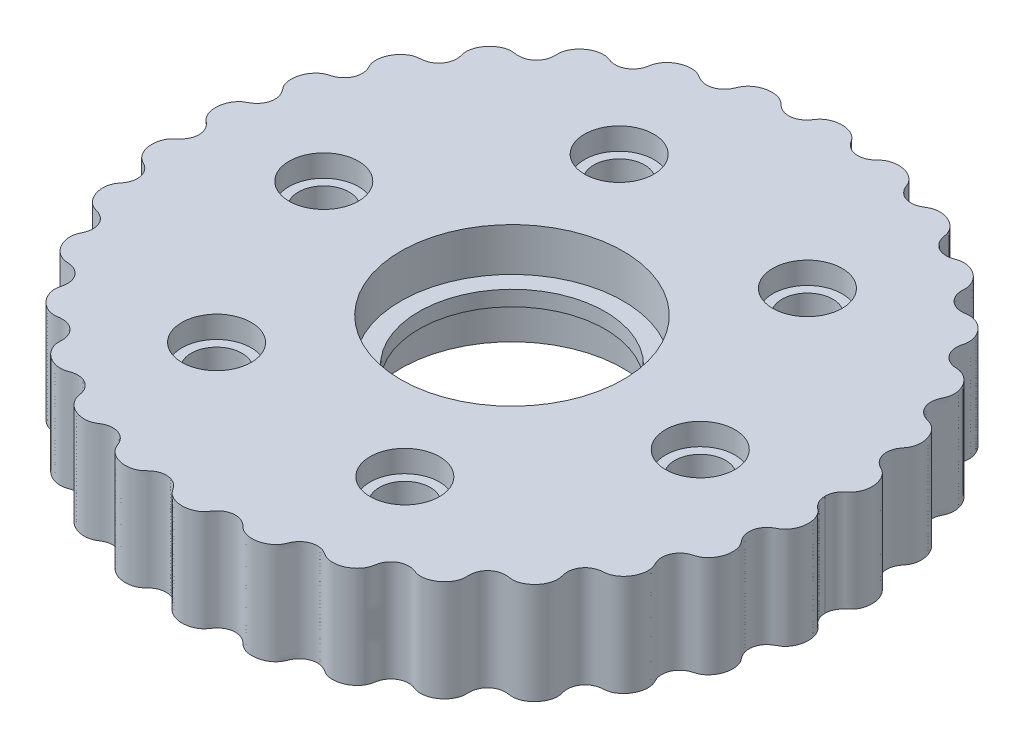
from build123d import *

# Parameters (mm, degrees)
BOSS_EXTRUDE2_DEPTH = 12
SKETCH6_R           = 4.1
CUT_EXTRUDE1_DEPTH  = 57.308702993
SKETCH7_R           = 13.15
CUT_EXTRUDE2_DEPTH  = 57.308702993
BOSS_EXTRUDE3_START = -9.4
SKETCH9_R           = 4.1
SKETCH9_R_2         = 3
BOSS_EXTRUDE3_DEPTH = 9.4
CIRPATTERN1_COUNT   = 6
SKETCH10_R          = 15
SKETCH10_R_2        = 11
BOSS_EXTRUDE4_DEPTH = 0.9


with BuildPart() as part:
    # Sketch5 → Boss-Extrude2 (new body)
    with BuildSketch(Plane(origin=(0, 0, 0), x_dir=(1, 0, 0), z_dir=(0, 1, 0))):
        with BuildLine():
            add(Edge.make_bspline(
                [(37.000000543, 0), (37.000000552, -0.009331134), (37.000966509, -0.171424116), (37.027070206, -0.409679845), (37.109321598, -0.716273392), (37.286261597, -1.078952504), (37.456824445, -1.324487686), (37.638362652, -1.52485155), (37.816819625, -1.687958329), (37.965246324, -1.811823941), (38.110225291, -1.939883113), (38.242117445, -2.08169884), (38.364952466, -2.243161776), (38.476615549, -2.423549989), (38.60066785, -2.673492576), (38.75424375, -3.109394369), (38.830307319, -3.632927608), (38.794292176, -4.2239939), (38.636848668, -4.797928431), (38.458890502, -5.183344411), (38.259405548, -5.487184723), (38.069505107, -5.707021167), (37.910862366, -5.85690611), (37.747040399, -5.982632822), (37.581182626, -6.08431324), (37.409262532, -6.175045447), (37.239463579, -6.269587357), (37.035066315, -6.401347188), (36.823394382, -6.571066904), (36.616578503, -6.787868402), (36.386380736, -7.119494054), (36.202652154, -7.537360036), (36.123975575, -7.987062037), (36.153590291, -8.437242816), (36.250456351, -8.815357689), (36.362978783, -9.082196629), (36.494221651, -9.309281938), (36.630083941, -9.501001968), (36.745699391, -9.649082743), (36.887252239, -9.836666119), (37.011266131, -10.051345791), (37.109368864, -10.292226805), (37.196288214, -10.611443823), (37.261909013, -11.081574388), (37.228744801, -11.621563903), (37.067186773, -12.203062395), (36.787563361, -12.738446309), (36.529525865, -13.079532461), (36.267442309, -13.33526978), (36.032623997, -13.509988526), (35.843612941, -13.622491105), (35.654601989, -13.709631656), (35.468926378, -13.772818106), (35.233120316, -13.838805413), (34.953875759, -13.931517528), (34.663032698, -14.072976375), (34.376392401, -14.275606179), (34.08511956, -14.559566304), (33.825233374, -14.936045378), (33.663332771, -15.362756008), (33.607510823, -15.808988758), (33.630241415, -16.195475852), (33.688792421, -16.476697926), (33.772611091, -16.723045921), (33.867027273, -16.936221606), (33.949151097, -17.103603609), (34.045620211, -17.3159684), (34.118259653, -17.55104717), (34.161123554, -17.80549671), (34.176642117, -18.133452615), (34.139990376, -18.603020205), (33.993802903, -19.119514254), (33.715292747, -19.649643893), (33.332605178, -20.110935737), (33.011583256, -20.388596999), (32.704572477, -20.582893614), (32.440787073, -20.704495969), (32.234310047, -20.775237155), (32.033040809, -20.821610611), (31.839904391, -20.845433979), (31.645883956, -20.85805711), (31.452290476, -20.876358937), (31.212166227, -20.915198636), (30.945924495, -20.987357063), (30.661712224, -21.107849), (30.304805692, -21.332562146), (29.964326123, -21.660076524), (29.717872228, -22.056290276), (29.577021526, -22.488973098), (29.525925808, -22.869493379), (29.529120795, -23.154434942), (29.563002852, -23.410385086), (29.612749759, -23.636381115), (29.658085535, -23.815826077), (29.705219825, -24.042553058), (29.723756744, -24.286058245), (29.71019054, -24.541725861), (29.654670682, -24.862775407), (29.519045475, -25.309928362), (29.266982699, -25.782122921), (28.881776698, -26.241648746), (28.406724995, -26.61299827), (28.027811952, -26.817810293), (27.680597553, -26.942068849), (27.391770251, -27.002991395), (27.170545775, -27.025851757), (26.95964549, -27.024757293), (26.761637939, -27.003079534), (26.564666788, -26.974537259), (26.36649682, -26.954976795), (26.117509902, -26.948552815), (25.761048422, -26.978767865), (25.308882571, -27.104292051), (24.82399189, -27.390850133), (24.414833141, -27.833890192), (24.171713809, -28.315389079), (24.072871169, -28.730278121), (24.04885786, -29.061600015), (24.052107268, -29.301235182), (24.059405849, -29.492811283), (24.054566832, -29.732676009), (24.00665518, -30.035462361), (23.889663083, -30.389531673), (23.628504038, -30.876963361), (23.248732953, -31.319620737), (22.779834744, -31.682021375), (22.239541076, -31.942932881), (21.822657715, -32.063017543), (21.454174138, -32.110045111), (21.156890702, -32.106816463), (20.934412753, -32.080593957), (20.727509337, -32.032609435), (20.537685466, -31.967834996), (20.349458661, -31.898960578), (20.157737512, -31.840018847), (19.913114009, -31.784469338), (19.554924705, -31.744675311), (19.083470078, -31.781408492), (18.550746814, -31.97168416), (18.121409228, -32.288341346), (17.83759494, -32.624204261), (17.650380906, -32.944672377), (17.544849761, -33.20217261), (17.476444072, -33.447334524), (17.432424993, -33.673761408), (17.400602662, -33.85557284), (17.347794446, -34.080346505), (17.261667886, -34.307758417), (17.142649249, -34.532709023), (16.959053561, -34.799074104), (16.652218459, -35.145911365), (16.228738386, -35.470018351), (15.687658965, -35.729259155), (15.098286894, -35.871191466), (14.662340956, -35.899758926), (14.289767353, -35.866240575), (13.998232661, -35.798125707), (13.785333178, -35.723404174), (13.592777376, -35.630258581), (13.420264948, -35.525172488), (13.248810245, -35.418581108), (13.07126992, -35.322090415), (12.840613485, -35.218901831), (12.494392949, -35.109600037), (12.021113687, -35.054785279), (11.459467432, -35.140976143), (10.976949371, -35.371555576), (10.635072377, -35.647612606), (10.391924904, -35.924840271), (10.240095725, -36.155495721), (10.126319561, -36.380626993), (10.038719371, -36.591463894), (9.969717125, -36.760672609), (9.869305887, -36.966034651), (9.736351706, -37.166831626), (9.572653976, -37.358665188), (9.337752536, -37.577163317), (8.966477077, -37.847931402), (8.49084148, -38.07119116), (7.919231414, -38.208465327), (7.329130718, -38.22615196), (6.912384672, -38.16985048), (6.566647583, -38.069475397), (6.298290075, -37.951321292), (6.101098907, -37.838579235), (5.922744538, -37.708104642), (5.764835617, -37.562935078), (5.611399096, -37.413468174), (5.449114463, -37.273252617), (5.23266547, -37.114897644), (4.903709259, -36.931207807), (4.43889295, -36.781365035), (3.865259393, -36.759207028), (3.283433549, -36.910613806), (2.828765266, -37.176018701), (2.531290016, -37.453197215), (2.335949698, -37.698334138), (2.210101872, -37.881225878), (2.110163931, -38.02810872), (1.973558845, -38.203429319), (1.771063045, -38.404846505), (1.48944576, -38.610665257), (1.025985501, -38.844567857), (0.498046272, -38.985247931), (-0.053180337, -39.022896951), (-0.605938875, -38.953489163), (-0.989950819, -38.843837832), (-1.303041648, -38.706345322), (-1.577360136, -38.545177989), (-1.777137251, -38.394986802), (-1.949465412, -38.230038213), (-2.091676668, -38.053880482), (-2.194368107, -37.904863668), (-2.321493849, -37.717909649), (-2.518004339, -37.466821079), (-2.818364982, -37.1827623), (-3.277228537, -36.912423315), (-3.863111662, -36.759124462), (-4.438892572, -36.781364749), (-4.903709467, -36.931207971), (-5.232665361, -37.114897556), (-5.449114527, -37.273252669), (-5.611399063, -37.413468147), (-5.764835632, -37.562935089), (-5.92274453, -37.708104638), (-6.101098913, -37.838579237), (-6.298290067, -37.951321292), (-6.566647597, -38.069475397), (-6.912384646, -38.169850482), (-7.329130761, -38.226151957), (-7.91923134, -38.208465334), (-8.490841609, -38.071191148), (-8.966476892, -37.847931419), (-9.337752758, -37.577163295), (-9.572653573, -37.358665226), (-9.736352607, -37.166831539), (-9.869304158, -36.966034816), (-9.96972047, -36.760672289), (-10.038709568, -36.591464835), (-10.126342093, -36.380624831), (-10.271278494, -36.093704594), (-10.513343454, -35.754971914), (-10.913760508, -35.40176101), (-11.459451313, -35.14097769), (-12.021124524, -35.054784239), (-12.49438679, -35.109600627), (-12.840616669, -35.218901526), (-13.071268033, -35.322090596), (-13.248811124, -35.418581024), (-13.420264643, -35.525172518), (-13.592777463, -35.630258572), (-13.785333147, -35.723404177), (-13.998232674, -35.798125706), (-14.289767346, -35.866240576), (-14.662340961, -35.899758925), (-15.098286891, -35.871191466), (-15.687658967, -35.729259155), (-16.228738385, -35.470018352), (-16.652218459, -35.145911365), (-16.95905356, -34.799074104), (-17.142649249, -34.532709023), (-17.261667886, -34.307758417), (-17.347794446, -34.080346505), (-17.400602662, -33.85557284), (-17.432424993, -33.673761408), (-17.476444072, -33.447334524), (-17.544849761, -33.20217261), (-17.650380906, -32.944672377), (-17.83759494, -32.624204261), (-18.121409228, -32.288341346), (-18.550746814, -31.97168416), (-19.083470078, -31.781408492), (-19.554924705, -31.744675311), (-19.913114009, -31.784469338), (-20.157737512, -31.840018847), (-20.349458661, -31.898960578), (-20.537685466, -31.967834996), (-20.727509337, -32.032609435), (-20.934412753, -32.080593957), (-21.156890702, -32.106816463), (-21.454174138, -32.110045111), (-21.822657715, -32.063017543), (-22.239541076, -31.942932881), (-22.779834744, -31.682021375), (-23.248732953, -31.319620737), (-23.628504038, -30.876963361), (-23.889663083, -30.389531673), (-24.00665518, -30.035462361), (-24.054566832, -29.732676009), (-24.059405849, -29.492811283), (-24.052107268, -29.301235182), (-24.04885786, -29.061600015), (-24.072871169, -28.730278121), (-24.171713809, -28.315389079), (-24.414833141, -27.833890192), (-24.82399189, -27.390850133), (-25.308882571, -27.104292051), (-25.761048422, -26.978767865), (-26.117509902, -26.948552815), (-26.36649682, -26.954976795), (-26.564666788, -26.974537259), (-26.761637939, -27.003079534), (-26.95964549, -27.024757293), (-27.170545775, -27.025851757), (-27.391770251, -27.002991395), (-27.680597553, -26.942068849), (-28.027811952, -26.817810293), (-28.406724995, -26.61299827), (-28.881776698, -26.241648746), (-29.266982699, -25.782122921), (-29.519045475, -25.309928362), (-29.654670682, -24.862775407), (-29.71019054, -24.541725861), (-29.723756744, -24.286058245), (-29.705219825, -24.042553058), (-29.658085535, -23.815826077), (-29.612749759, -23.636381115), (-29.563002852, -23.410385086), (-29.529120795, -23.154434942), (-29.525925808, -22.869493379), (-29.577021526, -22.488973098), (-29.717872228, -22.056290276), (-29.964326123, -21.660076524), (-30.304805692, -21.332562146), (-30.661712224, -21.107849), (-30.945924495, -20.987357063), (-31.212166227, -20.915198636), (-31.452290476, -20.876358937), (-31.645883956, -20.85805711), (-31.839904391, -20.845433979), (-32.033040809, -20.821610611), (-32.234310047, -20.775237155), (-32.440787073, -20.704495969), (-32.704572477, -20.582893614), (-33.011583256, -20.388596999), (-33.332605178, -20.110935737), (-33.715292747, -19.649643893), (-33.993802903, -19.119514254), (-34.139990376, -18.603020205), (-34.176642117, -18.133452615), (-34.161123554, -17.80549671), (-34.118259653, -17.55104717), (-34.045620211, -17.3159684), (-33.949151097, -17.103603609), (-33.867027273, -16.936221606), (-33.772611091, -16.723045921), (-33.688792421, -16.476697926), (-33.630241415, -16.195475852), (-33.607510823, -15.808988758), (-33.663332771, -15.362756008), (-33.825233374, -14.936045378), (-34.08511956, -14.559566304), (-34.376392401, -14.275606179), (-34.663032698, -14.072976375), (-34.953875759, -13.931517528), (-35.233120316, -13.838805413), (-35.468926378, -13.772818106), (-35.654601989, -13.709631656), (-35.843612941, -13.622491105), (-36.032623997, -13.509988526), (-36.267442309, -13.33526978), (-36.529525865, -13.079532461), (-36.787563361, -12.738446309), (-37.067186773, -12.203062395), (-37.228744801, -11.621563903), (-37.261909013, -11.081574388), (-37.196288214, -10.611443823), (-37.109368864, -10.292226805), (-37.011266131, -10.051345791), (-36.887252239, -9.836666119), (-36.745699391, -9.649082743), (-36.630083941, -9.501001968), (-36.494221651, -9.309281938), (-36.362978783, -9.082196629), (-36.250456351, -8.815357689), (-36.153590291, -8.437242816), (-36.123975575, -7.987062037), (-36.202652154, -7.537360036), (-36.386380736, -7.119494054), (-36.616578503, -6.787868402), (-36.823394382, -6.571066904), (-37.035066315, -6.401347188), (-37.239463579, -6.269587357), (-37.409262532, -6.175045447), (-37.581182626, -6.08431324), (-37.747040399, -5.982632822), (-37.910862366, -5.85690611), (-38.069505107, -5.707021167), (-38.259405548, -5.487184723), (-38.458890502, -5.183344411), (-38.636848668, -4.797928431), (-38.794292176, -4.2239939), (-38.830307319, -3.632927608), (-38.75424375, -3.109394369), (-38.60066785, -2.673492576), (-38.476615549, -2.423549989), (-38.364952466, -2.243161776), (-38.242117445, -2.08169884), (-38.110225291, -1.939883113), (-37.965246324, -1.811823941), (-37.816819625, -1.687958329), (-37.638362652, -1.52485155), (-37.456824445, -1.324487687), (-37.286261596, -1.078952504), (-37.109321598, -0.716273393), (-37.027070205, -0.409679844), (-37.000966509, -0.171424116), (-37.000000553, -0.009331134), (-37.000000543, 0)],
                knots=[0.109164453, 0.109164453, 0.109164453, 0.109164453, 0.109164453, 0.109374197, 0.112807951, 0.114524828, 0.116241704, 0.118414412, 0.119500765, 0.120587119, 0.121673472, 0.122759826, 0.123846179, 0.124932533, 0.126226897, 0.127521261, 0.130109988, 0.135287444, 0.138000846, 0.140714248, 0.14342765, 0.144784351, 0.146141052, 0.147233132, 0.148325212, 0.149417293, 0.150509373, 0.151601454, 0.152693534, 0.154877695, 0.15659254, 0.158307385, 0.161737075, 0.165054367, 0.166713014, 0.16837166, 0.170483268, 0.171539072, 0.172594876, 0.17365068, 0.174706484, 0.176818092, 0.178146984, 0.179475875, 0.182133657, 0.187449222, 0.190182597, 0.192915972, 0.195649347, 0.197016035, 0.198382722, 0.199483684, 0.200584646, 0.201685608, 0.20278657, 0.204988494, 0.207190417, 0.208917605, 0.210644794, 0.21409917, 0.21738911, 0.21903408, 0.22067905, 0.222774568, 0.223822327, 0.224870086, 0.225917845, 0.226965604, 0.229061122, 0.230379854, 0.231698586, 0.23433605, 0.239610977, 0.242323594, 0.245036211, 0.247748828, 0.249105136, 0.250461445, 0.251553921, 0.252646397, 0.253738873, 0.254831349, 0.255923825, 0.257016301, 0.259201253, 0.261016111, 0.262830969, 0.266460685, 0.269722758, 0.271353794, 0.27298483, 0.275064955, 0.276105017, 0.277145079, 0.278185142, 0.279225204, 0.281305329, 0.282613797, 0.283922265, 0.2865392, 0.291773071, 0.294525562, 0.297278052, 0.300030542, 0.301406787, 0.302783032, 0.303901474, 0.305019915, 0.306138357, 0.307256798, 0.308375239, 0.309493681, 0.311730563, 0.315275739, 0.318820915, 0.321962541, 0.325104167, 0.327258622, 0.32833585, 0.329413077, 0.330490304, 0.331567532, 0.333721986, 0.336275239, 0.338828492, 0.343934998, 0.346707206, 0.349479414, 0.352251622, 0.353637726, 0.35502383, 0.356150198, 0.357276567, 0.358402935, 0.359529304, 0.360655672, 0.361782041, 0.364034778, 0.367607117, 0.371179457, 0.374302506, 0.37586403, 0.377425555, 0.379499514, 0.380536493, 0.381573473, 0.382610452, 0.383647431, 0.38572139, 0.387018316, 0.388315242, 0.390909094, 0.396096799, 0.398888162, 0.401679525, 0.404470889, 0.40586657, 0.407262252, 0.408396802, 0.409531351, 0.410665901, 0.411800451, 0.412935, 0.41406955, 0.416338649, 0.41993733, 0.42353601, 0.426642941, 0.428196407, 0.429749872, 0.431802898, 0.432829411, 0.433855924, 0.434882437, 0.43590895, 0.437961976, 0.439249052, 0.440536128, 0.443110279, 0.448258581, 0.450946418, 0.453634256, 0.456322093, 0.457666011, 0.45900993, 0.460213939, 0.461417947, 0.462621956, 0.463825965, 0.465029973, 0.466233982, 0.468642, 0.472266184, 0.475890368, 0.478932941, 0.481975513, 0.483971651, 0.48496972, 0.485967788, 0.486965857, 0.487963926, 0.489960063, 0.492365045, 0.494770027, 0.499579991, 0.50213441, 0.50468883, 0.507243249, 0.508520459, 0.509797669, 0.511830665, 0.512847163, 0.51386366, 0.514880158, 0.515896656, 0.517929652, 0.521019785, 0.524109917, 0.527734102, 0.531358286, 0.533766303, 0.534970312, 0.536174321, 0.537378329, 0.538582338, 0.539786347, 0.540990355, 0.542334274, 0.543678193, 0.54636603, 0.549053867, 0.551741704, 0.556890007, 0.559464158, 0.560751233, 0.562038309, 0.564091335, 0.565117848, 0.566144361, 0.567170874, 0.568197387, 0.570250413, 0.573357344, 0.576464275, 0.580062956, 0.583661636, 0.585930735, 0.587065285, 0.588199835, 0.589334384, 0.590468934, 0.591603484, 0.592738033, 0.594133715, 0.595529397, 0.59832076, 0.601112123, 0.603903487, 0.609091191, 0.611685043, 0.612981969, 0.614278895, 0.616352854, 0.617389833, 0.618426813, 0.619463792, 0.620500772, 0.62257473, 0.624136255, 0.62569778, 0.628820829, 0.632393168, 0.635965507, 0.638218244, 0.639344613, 0.640470981, 0.64159735, 0.642723719, 0.643850087, 0.644976456, 0.64636256, 0.647748664, 0.650520872, 0.653293079, 0.656065287, 0.661171793, 0.663725046, 0.666278299, 0.668432754, 0.669509981, 0.670587208, 0.671664436, 0.672741663, 0.674896118, 0.678037744, 0.681179371, 0.684724546, 0.688269722, 0.690506605, 0.691625046, 0.692743487, 0.693861929, 0.69498037, 0.696098812, 0.697217253, 0.698593498, 0.699969743, 0.702722233, 0.705474724, 0.708227214, 0.713461085, 0.716078021, 0.717386488, 0.718694956, 0.720775081, 0.721815144, 0.722855206, 0.723895268, 0.724935331, 0.727015456, 0.728646492, 0.730277528, 0.7335396, 0.737169316, 0.738984174, 0.740799032, 0.742983985, 0.744076461, 0.745168937, 0.746261413, 0.747353889, 0.748446365, 0.749538841, 0.750895149, 0.752251457, 0.754964074, 0.757676691, 0.760389308, 0.765664236, 0.768301699, 0.769620431, 0.770939163, 0.773034681, 0.77408244, 0.775130199, 0.776177958, 0.777225717, 0.779321235, 0.780966205, 0.782611175, 0.785901115, 0.789355492, 0.79108268, 0.792809868, 0.795011792, 0.797213716, 0.798314677, 0.799415639, 0.800516601, 0.801617563, 0.802984251, 0.804350938, 0.807084313, 0.809817688, 0.812551063, 0.817866628, 0.820524411, 0.821853302, 0.823182193, 0.825293801, 0.826349605, 0.827405409, 0.828461213, 0.829517017, 0.831628625, 0.833287272, 0.834945918, 0.838263211, 0.841692901, 0.843407746, 0.845122591, 0.847306751, 0.848398832, 0.849490912, 0.850582993, 0.851675073, 0.852767153, 0.853859234, 0.855215935, 0.856572636, 0.859286038, 0.86199944, 0.864712842, 0.869890297, 0.872479025, 0.873773388, 0.875067752, 0.876154106, 0.877240459, 0.878326813, 0.879413167, 0.88049952, 0.881585874, 0.883758581, 0.885475458, 0.887192335, 0.890626089, 0.890835832, 0.890835832, 0.890835832, 0.890835832, 0.890835832], degree=4))
            add(Edge.make_bspline(
                [(37.000000543, 0), (37.000000552, 0.009331134), (37.000966509, 0.171424116), (37.027070206, 0.409679845), (37.109321598, 0.716273392), (37.286261597, 1.078952504), (37.456824445, 1.324487686), (37.638362652, 1.52485155), (37.816819625, 1.687958329), (37.965246324, 1.811823941), (38.110225291, 1.939883113), (38.242117445, 2.08169884), (38.364952466, 2.243161776), (38.476615549, 2.423549989), (38.60066785, 2.673492576), (38.75424375, 3.109394369), (38.830307319, 3.632927608), (38.794292176, 4.2239939), (38.636848668, 4.797928431), (38.458890502, 5.183344411), (38.259405548, 5.487184723), (38.069505107, 5.707021167), (37.910862366, 5.85690611), (37.747040399, 5.982632822), (37.581182626, 6.08431324), (37.409262532, 6.175045447), (37.239463579, 6.269587357), (37.035066315, 6.401347188), (36.823394382, 6.571066904), (36.616578503, 6.787868402), (36.386380736, 7.119494054), (36.202652154, 7.537360036), (36.123975575, 7.987062037), (36.153590291, 8.437242816), (36.250456351, 8.815357689), (36.362978783, 9.082196629), (36.494221651, 9.309281938), (36.630083941, 9.501001968), (36.745699391, 9.649082743), (36.887252239, 9.836666119), (37.011266131, 10.051345791), (37.109368864, 10.292226805), (37.196288214, 10.611443823), (37.261909013, 11.081574388), (37.228744801, 11.621563903), (37.067186773, 12.203062395), (36.787563361, 12.738446308), (36.529525865, 13.079532461), (36.267442309, 13.33526978), (36.032623997, 13.509988526), (35.843612941, 13.622491105), (35.654601989, 13.709631656), (35.468926378, 13.772818106), (35.233120316, 13.838805413), (34.953875759, 13.931517528), (34.663032698, 14.072976375), (34.376392401, 14.275606179), (34.08511956, 14.559566304), (33.825233374, 14.936045378), (33.663332771, 15.362756008), (33.607510823, 15.808988758), (33.630241415, 16.195475852), (33.688792421, 16.476697926), (33.772611091, 16.723045921), (33.867027273, 16.936221606), (33.949151097, 17.103603609), (34.045620211, 17.3159684), (34.118259653, 17.55104717), (34.161123554, 17.80549671), (34.176642117, 18.133452615), (34.139990376, 18.603020205), (33.993802903, 19.119514254), (33.715292747, 19.649643893), (33.332605178, 20.110935737), (33.011583256, 20.388596999), (32.704572477, 20.582893614), (32.440787073, 20.704495969), (32.234310047, 20.775237155), (32.033040809, 20.821610611), (31.839904391, 20.845433979), (31.645883956, 20.85805711), (31.452290476, 20.876358937), (31.212166227, 20.915198636), (30.945924495, 20.987357063), (30.661712224, 21.107849), (30.304805692, 21.332562146), (29.964326123, 21.660076524), (29.717872228, 22.056290276), (29.577021526, 22.488973098), (29.525925808, 22.869493379), (29.529120795, 23.154434942), (29.563002852, 23.410385086), (29.612749759, 23.636381115), (29.658085535, 23.815826077), (29.705219825, 24.042553058), (29.723756744, 24.286058245), (29.71019054, 24.541725861), (29.654670682, 24.862775407), (29.519045475, 25.309928362), (29.266982699, 25.782122921), (28.881776698, 26.241648746), (28.406724995, 26.61299827), (28.027811952, 26.817810293), (27.680597553, 26.942068849), (27.391770251, 27.002991395), (27.170545775, 27.025851757), (26.95964549, 27.024757293), (26.761637939, 27.003079534), (26.564666788, 26.974537259), (26.36649682, 26.954976795), (26.117509902, 26.948552815), (25.761048422, 26.978767865), (25.308882571, 27.104292051), (24.82399189, 27.390850133), (24.414833141, 27.833890192), (24.171713809, 28.315389079), (24.072871169, 28.730278121), (24.04885786, 29.061600015), (24.052107268, 29.301235182), (24.059405849, 29.492811283), (24.054566832, 29.732676009), (24.00665518, 30.035462361), (23.889663083, 30.389531673), (23.628504038, 30.876963361), (23.248732953, 31.319620737), (22.779834744, 31.682021375), (22.239541076, 31.942932881), (21.822657715, 32.063017543), (21.454174138, 32.110045111), (21.156890702, 32.106816462), (20.934412753, 32.080593957), (20.727509337, 32.032609435), (20.537685466, 31.967834996), (20.349458661, 31.898960578), (20.157737512, 31.840018847), (19.913114009, 31.784469338), (19.554924705, 31.744675311), (19.083470078, 31.781408492), (18.550746815, 31.97168416), (18.121409228, 32.288341346), (17.83759494, 32.624204261), (17.650380906, 32.944672377), (17.544849761, 33.20217261), (17.476444072, 33.447334524), (17.432424993, 33.673761408), (17.400602662, 33.85557284), (17.347794446, 34.080346505), (17.261667886, 34.307758417), (17.142649249, 34.532709023), (16.959053561, 34.799074104), (16.652218459, 35.145911365), (16.228738386, 35.470018351), (15.687658965, 35.729259155), (15.098286894, 35.871191466), (14.662340956, 35.899758926), (14.289767353, 35.866240575), (13.998232661, 35.798125707), (13.785333178, 35.723404174), (13.592777376, 35.630258581), (13.420264948, 35.525172488), (13.248810245, 35.418581108), (13.07126992, 35.322090415), (12.840613485, 35.218901831), (12.494392949, 35.109600037), (12.021113687, 35.054785279), (11.459467432, 35.140976143), (10.976949371, 35.371555575), (10.635072377, 35.647612606), (10.391924904, 35.924840271), (10.240095725, 36.155495721), (10.126319561, 36.380626993), (10.038719371, 36.591463894), (9.969717125, 36.760672609), (9.869305887, 36.966034651), (9.736351706, 37.166831626), (9.572653976, 37.358665188), (9.337752536, 37.577163317), (8.966477077, 37.847931402), (8.49084148, 38.07119116), (7.919231414, 38.208465327), (7.329130718, 38.22615196), (6.912384672, 38.16985048), (6.566647583, 38.069475397), (6.298290075, 37.951321292), (6.101098907, 37.838579235), (5.922744538, 37.708104642), (5.764835617, 37.562935078), (5.611399096, 37.413468174), (5.449114463, 37.273252617), (5.23266547, 37.114897644), (4.903709259, 36.931207807), (4.43889295, 36.781365035), (3.865259393, 36.759207028), (3.283433549, 36.910613806), (2.828765266, 37.176018701), (2.531290016, 37.453197215), (2.335949698, 37.698334138), (2.210101872, 37.881225878), (2.110163931, 38.02810872), (1.973558845, 38.203429319), (1.771063045, 38.404846505), (1.48944576, 38.610665257), (1.025985501, 38.844567857), (0.498046272, 38.985247931), (-0.053180337, 39.022896951), (-0.605938875, 38.953489163), (-0.989950819, 38.843837832), (-1.303041648, 38.706345322), (-1.577360136, 38.545177989), (-1.777137251, 38.394986802), (-1.949465412, 38.230038213), (-2.091676668, 38.053880482), (-2.194368107, 37.904863668), (-2.321493849, 37.717909649), (-2.518004339, 37.466821079), (-2.818364982, 37.1827623), (-3.277228537, 36.912423315), (-3.863111662, 36.759124462), (-4.438892572, 36.781364749), (-4.903709467, 36.931207971), (-5.232665361, 37.114897556), (-5.449114527, 37.273252669), (-5.611399063, 37.413468147), (-5.764835632, 37.562935089), (-5.92274453, 37.708104638), (-6.101098913, 37.838579237), (-6.298290067, 37.951321292), (-6.566647597, 38.069475397), (-6.912384646, 38.169850482), (-7.329130761, 38.226151957), (-7.91923134, 38.208465334), (-8.490841609, 38.071191148), (-8.966476892, 37.847931419), (-9.337752758, 37.577163295), (-9.572653573, 37.358665226), (-9.736352607, 37.166831539), (-9.869304158, 36.966034816), (-9.96972047, 36.760672289), (-10.038709568, 36.591464835), (-10.126342093, 36.380624831), (-10.271278494, 36.093704594), (-10.513343454, 35.754971914), (-10.913760508, 35.40176101), (-11.459451313, 35.14097769), (-12.021124524, 35.054784239), (-12.49438679, 35.109600627), (-12.840616669, 35.218901526), (-13.071268033, 35.322090596), (-13.248811124, 35.418581024), (-13.420264643, 35.525172518), (-13.592777463, 35.630258572), (-13.785333147, 35.723404177), (-13.998232674, 35.798125706), (-14.289767346, 35.866240576), (-14.662340961, 35.899758925), (-15.098286891, 35.871191466), (-15.687658967, 35.729259155), (-16.228738385, 35.470018352), (-16.652218459, 35.145911365), (-16.95905356, 34.799074104), (-17.142649249, 34.532709023), (-17.261667886, 34.307758417), (-17.347794446, 34.080346505), (-17.400602662, 33.85557284), (-17.432424993, 33.673761408), (-17.476444072, 33.447334524), (-17.544849761, 33.20217261), (-17.650380906, 32.944672377), (-17.83759494, 32.624204261), (-18.121409228, 32.288341346), (-18.550746814, 31.97168416), (-19.083470078, 31.781408492), (-19.554924705, 31.744675311), (-19.913114009, 31.784469338), (-20.157737512, 31.840018847), (-20.349458661, 31.898960578), (-20.537685466, 31.967834996), (-20.727509337, 32.032609435), (-20.934412753, 32.080593957), (-21.156890702, 32.106816463), (-21.454174138, 32.110045111), (-21.822657715, 32.063017543), (-22.239541076, 31.942932881), (-22.779834744, 31.682021375), (-23.248732953, 31.319620737), (-23.628504038, 30.876963361), (-23.889663083, 30.389531673), (-24.00665518, 30.035462361), (-24.054566832, 29.732676009), (-24.059405849, 29.492811283), (-24.052107268, 29.301235182), (-24.04885786, 29.061600015), (-24.072871169, 28.730278121), (-24.171713809, 28.315389079), (-24.414833141, 27.833890192), (-24.82399189, 27.390850133), (-25.308882571, 27.104292051), (-25.761048422, 26.978767865), (-26.117509902, 26.948552815), (-26.36649682, 26.954976795), (-26.564666788, 26.974537259), (-26.761637939, 27.003079534), (-26.95964549, 27.024757293), (-27.170545775, 27.025851757), (-27.391770251, 27.002991395), (-27.680597553, 26.942068849), (-28.027811952, 26.817810293), (-28.406724995, 26.61299827), (-28.881776698, 26.241648746), (-29.266982699, 25.782122921), (-29.519045475, 25.309928362), (-29.654670682, 24.862775407), (-29.71019054, 24.541725861), (-29.723756744, 24.286058245), (-29.705219825, 24.042553058), (-29.658085535, 23.815826077), (-29.612749759, 23.636381115), (-29.563002852, 23.410385086), (-29.529120795, 23.154434942), (-29.525925808, 22.869493379), (-29.577021526, 22.488973098), (-29.717872228, 22.056290276), (-29.964326123, 21.660076524), (-30.304805692, 21.332562146), (-30.661712224, 21.107849), (-30.945924495, 20.987357063), (-31.212166227, 20.915198636), (-31.452290476, 20.876358937), (-31.645883956, 20.85805711), (-31.839904391, 20.845433979), (-32.033040809, 20.821610611), (-32.234310047, 20.775237155), (-32.440787073, 20.704495969), (-32.704572477, 20.582893614), (-33.011583256, 20.388596999), (-33.332605178, 20.110935737), (-33.715292747, 19.649643893), (-33.993802903, 19.119514254), (-34.139990376, 18.603020205), (-34.176642117, 18.133452615), (-34.161123554, 17.80549671), (-34.118259653, 17.55104717), (-34.045620211, 17.3159684), (-33.949151097, 17.103603609), (-33.867027273, 16.936221606), (-33.772611091, 16.723045921), (-33.688792421, 16.476697926), (-33.630241415, 16.195475852), (-33.607510823, 15.808988758), (-33.663332771, 15.362756008), (-33.825233374, 14.936045378), (-34.08511956, 14.559566304), (-34.376392401, 14.275606179), (-34.663032698, 14.072976375), (-34.953875759, 13.931517528), (-35.233120316, 13.838805413), (-35.468926378, 13.772818106), (-35.654601989, 13.709631656), (-35.843612941, 13.622491105), (-36.032623997, 13.509988526), (-36.267442309, 13.33526978), (-36.529525865, 13.079532461), (-36.787563361, 12.738446309), (-37.067186773, 12.203062395), (-37.228744801, 11.621563903), (-37.261909013, 11.081574388), (-37.196288214, 10.611443823), (-37.109368864, 10.292226805), (-37.011266131, 10.051345791), (-36.887252239, 9.836666119), (-36.745699391, 9.649082743), (-36.630083941, 9.501001968), (-36.494221651, 9.309281938), (-36.362978783, 9.082196629), (-36.250456351, 8.815357689), (-36.153590291, 8.437242816), (-36.123975575, 7.987062037), (-36.202652154, 7.537360036), (-36.386380736, 7.119494054), (-36.616578503, 6.787868402), (-36.823394382, 6.571066904), (-37.035066315, 6.401347188), (-37.239463579, 6.269587357), (-37.409262532, 6.175045447), (-37.581182626, 6.08431324), (-37.747040399, 5.982632822), (-37.910862366, 5.85690611), (-38.069505107, 5.707021167), (-38.259405548, 5.487184723), (-38.458890502, 5.183344411), (-38.636848668, 4.797928431), (-38.794292176, 4.2239939), (-38.830307319, 3.632927608), (-38.75424375, 3.109394369), (-38.60066785, 2.673492576), (-38.476615549, 2.423549989), (-38.364952466, 2.243161776), (-38.242117445, 2.08169884), (-38.110225291, 1.939883113), (-37.965246324, 1.811823941), (-37.816819625, 1.687958329), (-37.638362652, 1.52485155), (-37.456824445, 1.324487687), (-37.286261596, 1.078952504), (-37.109321598, 0.716273393), (-37.027070205, 0.409679844), (-37.000966509, 0.171424116), (-37.000000553, 0.009331134), (-37.000000543, 0)],
                knots=[0.109164453, 0.109164453, 0.109164453, 0.109164453, 0.109164453, 0.109374197, 0.112807951, 0.114524828, 0.116241704, 0.118414412, 0.119500765, 0.120587119, 0.121673472, 0.122759826, 0.123846179, 0.124932533, 0.126226897, 0.127521261, 0.130109988, 0.135287444, 0.138000846, 0.140714248, 0.14342765, 0.144784351, 0.146141052, 0.147233132, 0.148325212, 0.149417293, 0.150509373, 0.151601454, 0.152693534, 0.154877695, 0.15659254, 0.158307385, 0.161737075, 0.165054367, 0.166713014, 0.16837166, 0.170483268, 0.171539072, 0.172594876, 0.17365068, 0.174706484, 0.176818092, 0.178146984, 0.179475875, 0.182133657, 0.187449222, 0.190182597, 0.192915972, 0.195649347, 0.197016035, 0.198382722, 0.199483684, 0.200584646, 0.201685608, 0.20278657, 0.204988494, 0.207190417, 0.208917605, 0.210644794, 0.21409917, 0.21738911, 0.21903408, 0.22067905, 0.222774568, 0.223822327, 0.224870086, 0.225917845, 0.226965604, 0.229061122, 0.230379854, 0.231698586, 0.23433605, 0.239610977, 0.242323594, 0.245036211, 0.247748828, 0.249105136, 0.250461445, 0.251553921, 0.252646397, 0.253738873, 0.254831349, 0.255923825, 0.257016301, 0.259201253, 0.261016111, 0.262830969, 0.266460685, 0.269722758, 0.271353794, 0.27298483, 0.275064955, 0.276105017, 0.277145079, 0.278185142, 0.279225204, 0.281305329, 0.282613797, 0.283922265, 0.2865392, 0.291773071, 0.294525562, 0.297278052, 0.300030542, 0.301406787, 0.302783032, 0.303901474, 0.305019915, 0.306138357, 0.307256798, 0.308375239, 0.309493681, 0.311730563, 0.315275739, 0.318820915, 0.321962541, 0.325104167, 0.327258622, 0.32833585, 0.329413077, 0.330490304, 0.331567532, 0.333721986, 0.336275239, 0.338828492, 0.343934998, 0.346707206, 0.349479414, 0.352251622, 0.353637726, 0.35502383, 0.356150198, 0.357276567, 0.358402935, 0.359529304, 0.360655672, 0.361782041, 0.364034778, 0.367607117, 0.371179457, 0.374302506, 0.37586403, 0.377425555, 0.379499514, 0.380536493, 0.381573473, 0.382610452, 0.383647431, 0.38572139, 0.387018316, 0.388315242, 0.390909094, 0.396096799, 0.398888162, 0.401679525, 0.404470889, 0.40586657, 0.407262252, 0.408396802, 0.409531351, 0.410665901, 0.411800451, 0.412935, 0.41406955, 0.416338649, 0.41993733, 0.42353601, 0.426642941, 0.428196407, 0.429749872, 0.431802898, 0.432829411, 0.433855924, 0.434882437, 0.43590895, 0.437961976, 0.439249052, 0.440536128, 0.443110279, 0.448258581, 0.450946418, 0.453634256, 0.456322093, 0.457666011, 0.45900993, 0.460213939, 0.461417947, 0.462621956, 0.463825965, 0.465029973, 0.466233982, 0.468642, 0.472266184, 0.475890368, 0.478932941, 0.481975513, 0.483971651, 0.48496972, 0.485967788, 0.486965857, 0.487963926, 0.489960063, 0.492365045, 0.494770027, 0.499579991, 0.50213441, 0.50468883, 0.507243249, 0.508520459, 0.509797669, 0.511830665, 0.512847163, 0.51386366, 0.514880158, 0.515896656, 0.517929652, 0.521019785, 0.524109917, 0.527734102, 0.531358286, 0.533766303, 0.534970312, 0.536174321, 0.537378329, 0.538582338, 0.539786347, 0.540990355, 0.542334274, 0.543678193, 0.54636603, 0.549053867, 0.551741704, 0.556890007, 0.559464158, 0.560751233, 0.562038309, 0.564091335, 0.565117848, 0.566144361, 0.567170874, 0.568197387, 0.570250413, 0.573357344, 0.576464275, 0.580062956, 0.583661636, 0.585930735, 0.587065285, 0.588199835, 0.589334384, 0.590468934, 0.591603484, 0.592738033, 0.594133715, 0.595529397, 0.59832076, 0.601112123, 0.603903487, 0.609091191, 0.611685043, 0.612981969, 0.614278895, 0.616352854, 0.617389833, 0.618426813, 0.619463792, 0.620500772, 0.62257473, 0.624136255, 0.62569778, 0.628820829, 0.632393168, 0.635965507, 0.638218244, 0.639344613, 0.640470981, 0.64159735, 0.642723719, 0.643850087, 0.644976456, 0.64636256, 0.647748664, 0.650520872, 0.653293079, 0.656065287, 0.661171793, 0.663725046, 0.666278299, 0.668432754, 0.669509981, 0.670587208, 0.671664436, 0.672741663, 0.674896118, 0.678037744, 0.681179371, 0.684724546, 0.688269722, 0.690506605, 0.691625046, 0.692743487, 0.693861929, 0.69498037, 0.696098812, 0.697217253, 0.698593498, 0.699969743, 0.702722233, 0.705474724, 0.708227214, 0.713461085, 0.716078021, 0.717386488, 0.718694956, 0.720775081, 0.721815144, 0.722855206, 0.723895268, 0.724935331, 0.727015456, 0.728646492, 0.730277528, 0.7335396, 0.737169316, 0.738984174, 0.740799032, 0.742983985, 0.744076461, 0.745168937, 0.746261413, 0.747353889, 0.748446365, 0.749538841, 0.750895149, 0.752251457, 0.754964074, 0.757676691, 0.760389308, 0.765664236, 0.768301699, 0.769620431, 0.770939163, 0.773034681, 0.77408244, 0.775130199, 0.776177958, 0.777225717, 0.779321235, 0.780966205, 0.782611175, 0.785901115, 0.789355492, 0.79108268, 0.792809868, 0.795011792, 0.797213716, 0.798314677, 0.799415639, 0.800516601, 0.801617563, 0.802984251, 0.804350938, 0.807084313, 0.809817688, 0.812551063, 0.817866628, 0.820524411, 0.821853302, 0.823182193, 0.825293801, 0.826349605, 0.827405409, 0.828461213, 0.829517017, 0.831628625, 0.833287272, 0.834945918, 0.838263211, 0.841692901, 0.843407746, 0.845122591, 0.847306751, 0.848398832, 0.849490912, 0.850582993, 0.851675073, 0.852767153, 0.853859234, 0.855215935, 0.856572636, 0.859286038, 0.86199944, 0.864712842, 0.869890297, 0.872479025, 0.873773388, 0.875067752, 0.876154106, 0.877240459, 0.878326813, 0.879413167, 0.88049952, 0.881585874, 0.883758581, 0.885475458, 0.887192335, 0.890626089, 0.890835832, 0.890835832, 0.890835832, 0.890835832, 0.890835832], degree=4))
        make_face()
    extrude(amount=BOSS_EXTRUDE2_DEPTH)

    # Sketch6 → Cut-Extrude1 (cut, through all)
    with BuildSketch(Plane(origin=(0, 12, 0), x_dir=(1, 0, 0), z_dir=(0, 1, 0))):
        with Locations(Location((-24.86304614, 2.613223418, 0), (0, 0, 270))):
            Circle(SKETCH6_R)
        with Locations(Location((-10.168405204, 22.838641282, 0), (0, 0, 270))):
            Circle(SKETCH6_R)
        with Locations(Location((14.694640936, 20.225417864, 0), (0, 0, 270))):
            Circle(SKETCH6_R)
        with Locations(Location((24.86304614, -2.613223418, 0), (0, 0, 270))):
            Circle(SKETCH6_R)
        with Locations(Location((10.168405204, -22.838641282, 0), (0, 0, 270))):
            Circle(SKETCH6_R)
        with Locations(Location((-14.694640936, -20.225417864, 0), (0, 0, 270))):
            Circle(SKETCH6_R)
    extrude(amount=-CUT_EXTRUDE1_DEPTH, mode=Mode.SUBTRACT)

    # Sketch7 → Cut-Extrude2 (cut, through all)
    with BuildSketch(Plane(origin=(0, 12, 0), x_dir=(1, 0, 0), z_dir=(0, 1, 0))):
        with Locations(Location((0, 0, 0), (0, 0, 270))):
            Circle(SKETCH7_R)
    extrude(amount=-CUT_EXTRUDE2_DEPTH, mode=Mode.SUBTRACT)

    # Sketch9 → Boss-Extrude3 (add)
    with BuildSketch(Plane.XZ.offset(BOSS_EXTRUDE3_START)):
        with Locations(Location((-14.694640936, 20.225417864, 0), (0, 0, 90))):
            Circle(SKETCH9_R)
        with Locations(Location((-14.694640936, 20.225417864, 0), (0, 0, 270))):
            Circle(SKETCH9_R_2, mode=Mode.SUBTRACT)
    boss_extrude3 = extrude(amount=BOSS_EXTRUDE3_DEPTH)

    # CirPattern1: Boss-Extrude3 ×6 about axis
    cirpattern1_axis = Axis((0, 0, 0), (0, 1, 0))
    for i in range(1, CIRPATTERN1_COUNT):
        add(boss_extrude3.rotate(cirpattern1_axis, i * 360 / CIRPATTERN1_COUNT))

    # Sketch10 → Boss-Extrude4 (add, symmetric)
    with BuildSketch(Plane(origin=(0, 6, 0), x_dir=(1, 0, 0), z_dir=(0, 1, 0))):
        Circle(SKETCH10_R)
        with Locations(Location((0, 0, 0), (0, 0, 270))):
            Circle(SKETCH10_R_2, mode=Mode.SUBTRACT)
    extrude(amount=BOSS_EXTRUDE4_DEPTH, both=True)


solid = part.part
